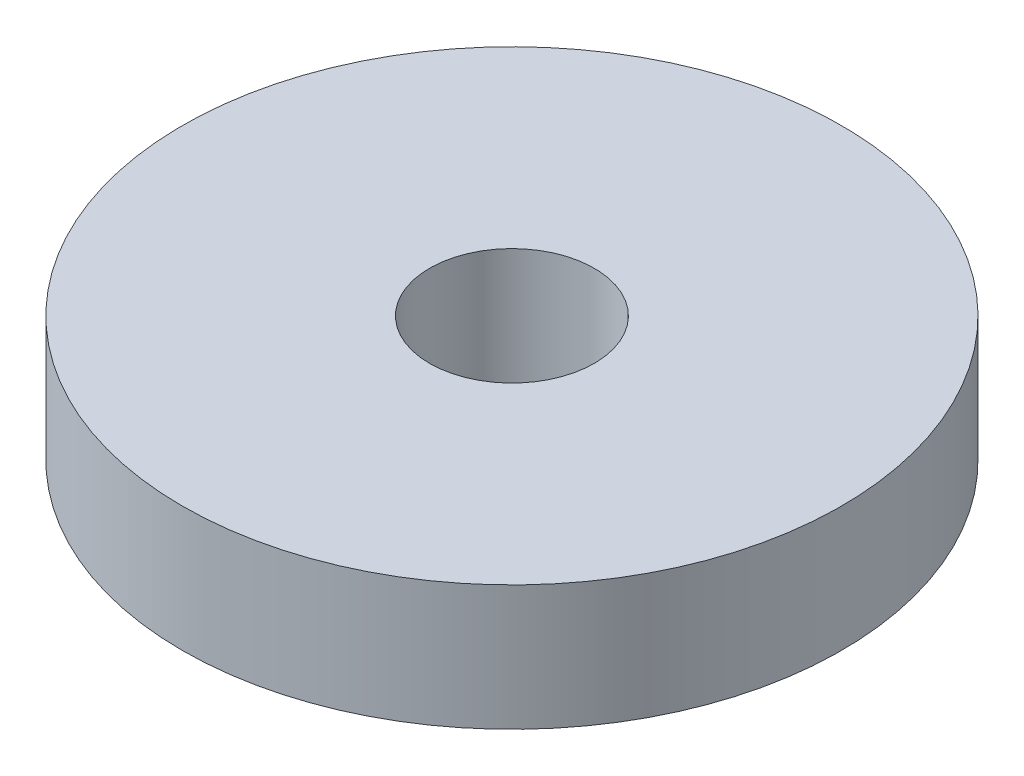
from build123d import *

# Parameters (mm, degrees)
SKETCH1_R           = 6.35
SKETCH1_R_2         = 1.5875
BOSS_EXTRUDE1_DEPTH = 2.41


with BuildPart() as part:
    # Sketch1 → Boss-Extrude1 (new body)
    with BuildSketch(Plane(origin=(0, 0, 0), x_dir=(1, 0, 0), z_dir=(0, 1, 0))):
        with Locations(Location((0, 0, 0), (0, 0, 270))):
            Circle(SKETCH1_R)
        with Locations(Location((0, 0, 0), (0, 0, 270))):
            Circle(SKETCH1_R_2, mode=Mode.SUBTRACT)
    extrude(amount=BOSS_EXTRUDE1_DEPTH)


solid = part.part
